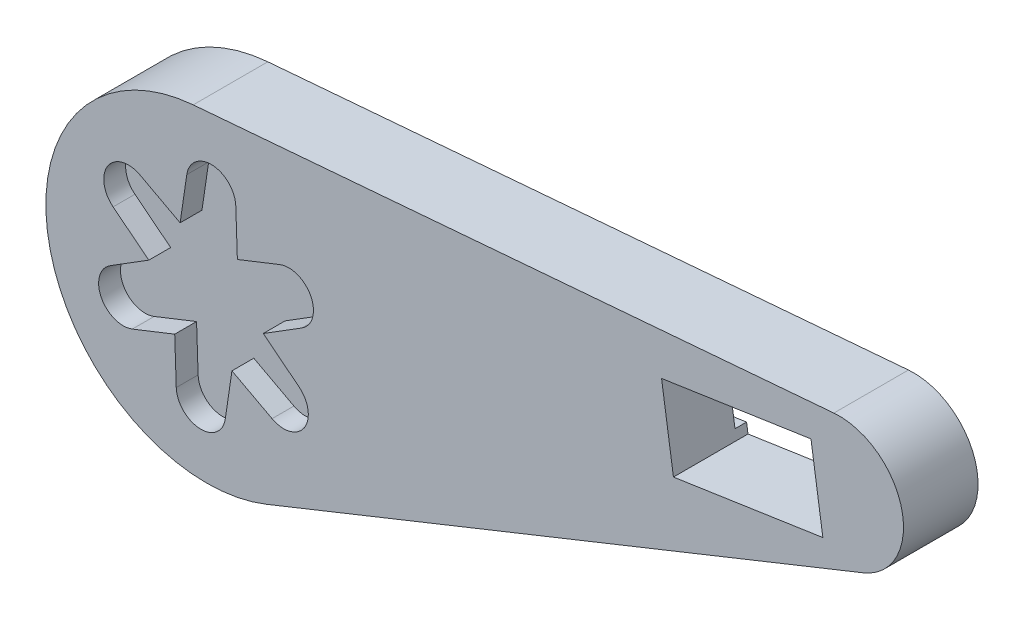
from build123d import *

# Parameters (mm, degrees)
EXTRUDE_5_DEPTH      = 15
CUT_EXTRUDE_8_DEPTH  = 5.2
CUT_EXTRUDE_9_DEPTH  = 15
CUT_EXTRUDE_10_DEPTH = 3.4
CUT_EXTRUDE_START    = -3.4
CUT_EXTRUDE_11_DEPTH = 3.4


with BuildPart() as part:
    # 草图1 → 凸台-拉伸5 (new body)
    with BuildSketch(Plane.XY):
        with BuildLine():
            Line((0, 0), (99.654203795, 8.309011134))
            ThreePointArc((99.654203795, 8.309011134), (110.217015146, 0.643574044), (104.203277967, -10.939468499))
            Line((104.203277967, -10.939468499), (11.372685429, -48.121199083))
            ThreePointArc((11.372685429, -48.121199083), (-22.25252281, -30.663509172), (0, 0))
        make_face()
    extrude(amount=EXTRUDE_5_DEPTH)

    # 草图9 → 切除-拉伸8 (cut)
    with BuildSketch(Plane(origin=(0, 0, 0), x_dir=(-1, 0, 0), z_dir=(0, 0, -1))):
        Polygon((-68.085389778, -2.37029612), (-73.03044485, -1.631086857), (-74.4743179, -11.290099671), (-69.529262828, -12.029308935), align=None)
    extrude(amount=-CUT_EXTRUDE_8_DEPTH, mode=Mode.SUBTRACT)

    # 草图9<5> → 切除-拉伸9 (cut)
    with BuildSketch(Plane(origin=(0, 0, 0), x_dir=(-1, 0, 0), z_dir=(0, 0, -1))):
        Polygon((-96.092530155, 3.045150664), (-72.850771317, -0.429132874), (-74.698794475, -12.791770554), (-97.940553313, -9.317487016), align=None)
    extrude(amount=-CUT_EXTRUDE_9_DEPTH, mode=Mode.SUBTRACT)

    # 草图1<11> → 切除-拉伸10 (cut)
    with BuildSketch(Plane.XY):
        with BuildLine():
            Line((0, 0), (99.654203795, 8.309011134))
            ThreePointArc((99.654203795, 8.309011134), (110.217015146, 0.643574044), (104.203277967, -10.939468499))
            Line((104.203277967, -10.939468499), (11.372685429, -48.121199083))
            ThreePointArc((11.372685429, -48.121199083), (-22.25252281, -30.663509172), (0, 0))
        make_face()
        with BuildLine():
            Line((6.86492087, -17.396188185), (6.623748603, -10.329097007))
            ThreePointArc((6.623748603, -10.329097007), (3.006492414, -6.630818399), (-1.003160039, -9.899532856))
            Line((-1.003160039, -9.899532856), (-2.038566002, -16.909799595))
            Line((-2.038566002, -16.909799595), (-8.279432627, -13.585115317))
            ThreePointArc((-8.279432627, -13.585115317), (-13.290863946, -14.868611764), (-12.464900415, -19.975429877))
            Line((-12.464900415, -19.975429877), (-6.911534313, -24.377251114))
            Line((-6.911534313, -24.377251114), (-12.91122867, -28.119658014))
            ThreePointArc((-12.91122867, -28.119658014), (-14.305403801, -33.101433069), (-9.469787817, -34.939536725))
            Line((-9.469787817, -34.939536725), (-2.881015752, -32.331091223))
            Line((-2.881015752, -32.331091223), (-2.639843484, -39.398182401))
            ThreePointArc((-2.639843484, -39.398182401), (0.977412704, -43.096461009), (4.987065158, -39.827746552))
            Line((4.987065158, -39.827746552), (6.022471121, -32.817479812))
            Line((6.022471121, -32.817479812), (12.263337746, -36.142164091))
            ThreePointArc((12.263337746, -36.142164091), (17.274769065, -34.858667644), (16.448805534, -29.751849531))
            Line((16.448805534, -29.751849531), (10.895439432, -25.350028294))
            Line((10.895439432, -25.350028294), (16.895133789, -21.607621394))
            ThreePointArc((16.895133789, -21.607621394), (18.28930892, -16.625846339), (13.453692935, -14.787742683))
            Line((13.453692935, -14.787742683), (6.86492087, -17.396188185))
        make_face(mode=Mode.SUBTRACT)
    extrude(amount=CUT_EXTRUDE_10_DEPTH, mode=Mode.SUBTRACT)

    # 草图25 → 切除-拉伸11 (cut)
    with BuildSketch(Plane.XY.offset(15).offset(CUT_EXTRUDE_START)):
        with BuildLine():
            Line((-1.003160039, -9.899532856), (-2.038566002, -16.909799595))
            Line((-2.038566002, -16.909799595), (-8.279432627, -13.585115317))
            ThreePointArc((-8.279432627, -13.585115317), (-13.290863946, -14.868611764), (-12.464900415, -19.975429877))
            Line((-12.464900415, -19.975429877), (-6.911534313, -24.377251114))
            Line((-6.911534313, -24.377251114), (-12.91122867, -28.119658014))
            ThreePointArc((-12.91122867, -28.119658014), (-14.305403801, -33.101433069), (-9.469787817, -34.939536725))
            Line((-9.469787817, -34.939536725), (-2.881015752, -32.331091223))
            Line((-2.881015752, -32.331091223), (-2.639843484, -39.398182401))
            ThreePointArc((-2.639843484, -39.398182401), (0.977412704, -43.096461009), (4.987065158, -39.827746552))
            Line((4.987065158, -39.827746552), (6.022471121, -32.817479812))
            Line((6.022471121, -32.817479812), (12.263337746, -36.142164091))
            ThreePointArc((12.263337746, -36.142164091), (17.274769065, -34.858667644), (16.448805534, -29.751849531))
            Line((16.448805534, -29.751849531), (10.895439432, -25.350028294))
            Line((10.895439432, -25.350028294), (16.895133789, -21.607621394))
            ThreePointArc((16.895133789, -21.607621394), (18.28930892, -16.625846339), (13.453692935, -14.787742683))
            Line((13.453692935, -14.787742683), (6.86492087, -17.396188185))
            Line((6.86492087, -17.396188185), (6.623748603, -10.329097007))
            ThreePointArc((6.623748603, -10.329097007), (3.006492414, -6.630818399), (-1.003160039, -9.899532856))
        make_face()
    extrude(amount=CUT_EXTRUDE_11_DEPTH, mode=Mode.SUBTRACT)


solid = part.part
